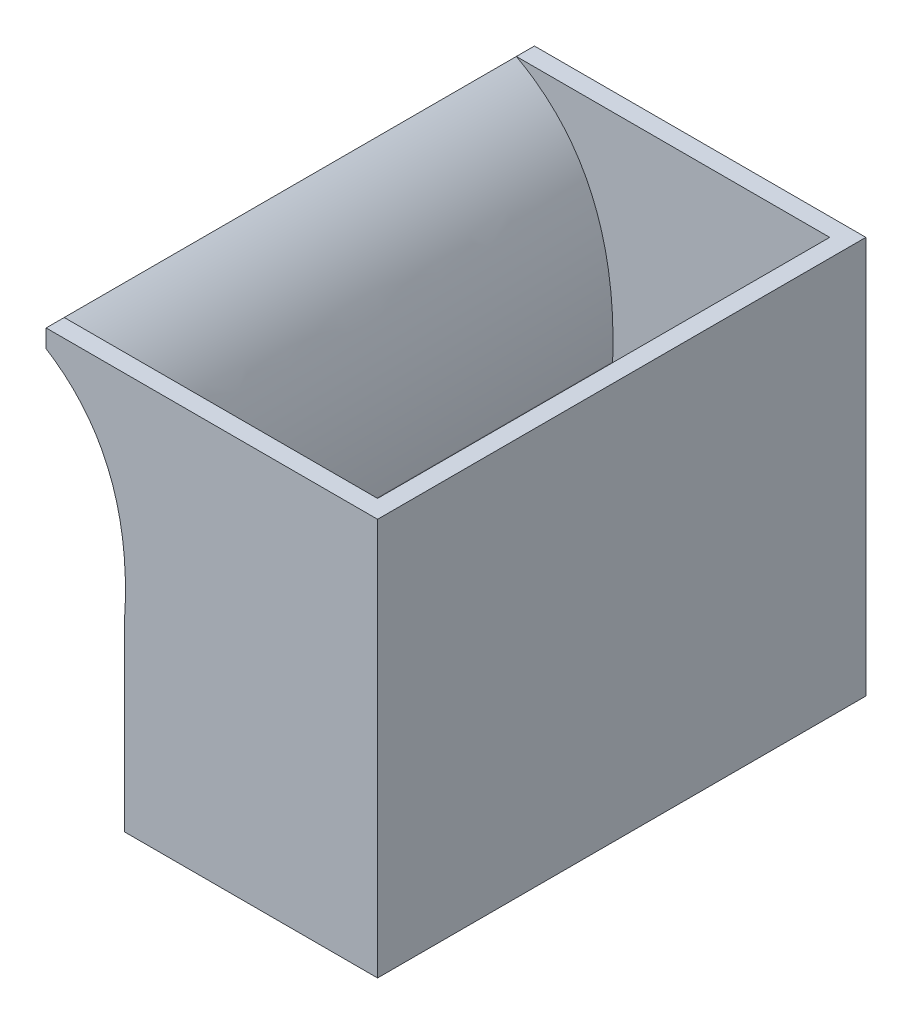
from build123d import *

# Parameters (mm, degrees)
SKETCH7_W               = 25.4
SKETCH7_H               = 303.92823255
BOSS_EXTRUDE2_DEPTH     = 635
BOSS_EXTRUDE2_2_DEPTH   = 635
SKETCH9_W               = 465.483389799
SKETCH9_H               = 303.92823255
BOSS_EXTRUDE3_DEPTH     = 25.4
SKETCH10_W              = 465.483389799
SKETCH10_H              = 303.92823255
BOSS_EXTRUDE4_DEPTH     = 25.4
CUT_EXTRUDE1_DEPTH      = 2380.234
CUT_EXTRUDE1_DEPTH_BACK = 125.476
SKETCH12_W              = 355.6
SKETCH12_H              = 685.8
BOSS_EXTRUDE5_DEPTH     = 254
SKETCH13_W              = 304.8
SKETCH13_H              = 635
CUT_EXTRUDE2_DEPTH      = 551.942


with BuildPart() as part:
    # Sketch7 → Boss-Extrude2 (new body)
    with BuildSketch(Plane.XY):
        with Locations((419.881001745, 151.964116275)):
            Rectangle(SKETCH7_W, SKETCH7_H)
    extrude(amount=BOSS_EXTRUDE2_DEPTH)



with BuildPart() as body_2:
    # Sketch7 → Boss-Extrude2 2 (new body)
    with BuildSketch(Plane.XY):
        with BuildLine():
            Line((-32.902388054, 303.92823255), (-32.902388054, 278.52823255))
            add(Edge.make_bspline(
                [(0, 254), (-15.04510801, 267.251537687), (-32.902388054, 278.52823255)],
                knots=[0.866081735, 0.866081735, 0.866081735, 1, 1, 1], degree=2))
            add(Edge.make_bspline(
                [(76.981001745, 0), (97.30034402, 168.299108064), (0, 254)],
                knots=[0, 0, 0, 0.866081735, 0.866081735, 0.866081735], degree=2))
            Line((76.981001745, 0), (102.381001745, 0))
            add(Edge.make_bspline(
                [(102.381001745, 0), (111.38603621, 225.968646172), (-32.902388054, 303.92823255)],
                knots=[0, 0, 0, 0.936348865, 0.936348865, 0.936348865], degree=2))
        make_face()
    extrude(amount=BOSS_EXTRUDE2_2_DEPTH)


with BuildPart() as part_1:
    add(part.part)

    add(body_2.part)  # Boss-Extrude3 merges body 2
    # Sketch9 → Boss-Extrude3 (add)
    with BuildSketch(Plane.XY.offset(635)):
        with Locations((199.839306846, 151.964116275)):
            Rectangle(SKETCH9_W, SKETCH9_H)
    extrude(amount=BOSS_EXTRUDE3_DEPTH)

    # Sketch10 → Boss-Extrude4 (add)
    with BuildSketch(Plane(origin=(0, 0, 0), x_dir=(-1, 0, 0), z_dir=(0, 0, -1))):
        with Locations((-199.839306846, 151.964116275)):
            Rectangle(SKETCH10_W, SKETCH10_H)
    extrude(amount=BOSS_EXTRUDE4_DEPTH)

    # Sketch11 → Cut-Extrude1 (cut, two sides: drawn at the far end of the back side and taken through both)
    with BuildSketch(Plane(origin=(0, 0, 635), x_dir=(-1, 0, 0), z_dir=(0, 0, -1)).offset(-CUT_EXTRUDE1_DEPTH_BACK)):
        with BuildLine():
            Line((32.902388054, 0), (32.902388054, 278.52823255))
            add(Edge.make_bspline(
                [(32.902388054, 278.52823255), (26.814117535, 274.683550229), (21.052735145, 270.6093113)],
                knots=[0, 0, 0, 0.045658164, 0.045658164, 0.045658164], degree=2))
            add(Edge.make_bspline(
                [(-76.981001745, 0), (-90.995301199, 190.717013874), (21.052735145, 270.6093113)],
                knots=[0, 0, 0, 0.870425908, 0.870425908, 0.870425908], degree=2))
            Line((-76.981001745, 0), (32.902388054, 0))
        make_face()
    extrude(amount=CUT_EXTRUDE1_DEPTH + CUT_EXTRUDE1_DEPTH_BACK, mode=Mode.SUBTRACT)

    # Sketch12 → Boss-Extrude5 (add)
    with BuildSketch(Plane.XZ):
        with Locations((254.781001745, 317.5)):
            Rectangle(SKETCH12_W, SKETCH12_H)
    extrude(amount=BOSS_EXTRUDE5_DEPTH)

    # Sketch13 → Cut-Extrude2 (cut)
    with BuildSketch(Plane(origin=(0, 0, 0), x_dir=(1, 0, 0), z_dir=(0, 1, 0))):
        with Locations((254.781001745, -317.5)):
            Rectangle(SKETCH13_W, SKETCH13_H)
    extrude(amount=-CUT_EXTRUDE2_DEPTH, mode=Mode.SUBTRACT)


solid = part_1.part
